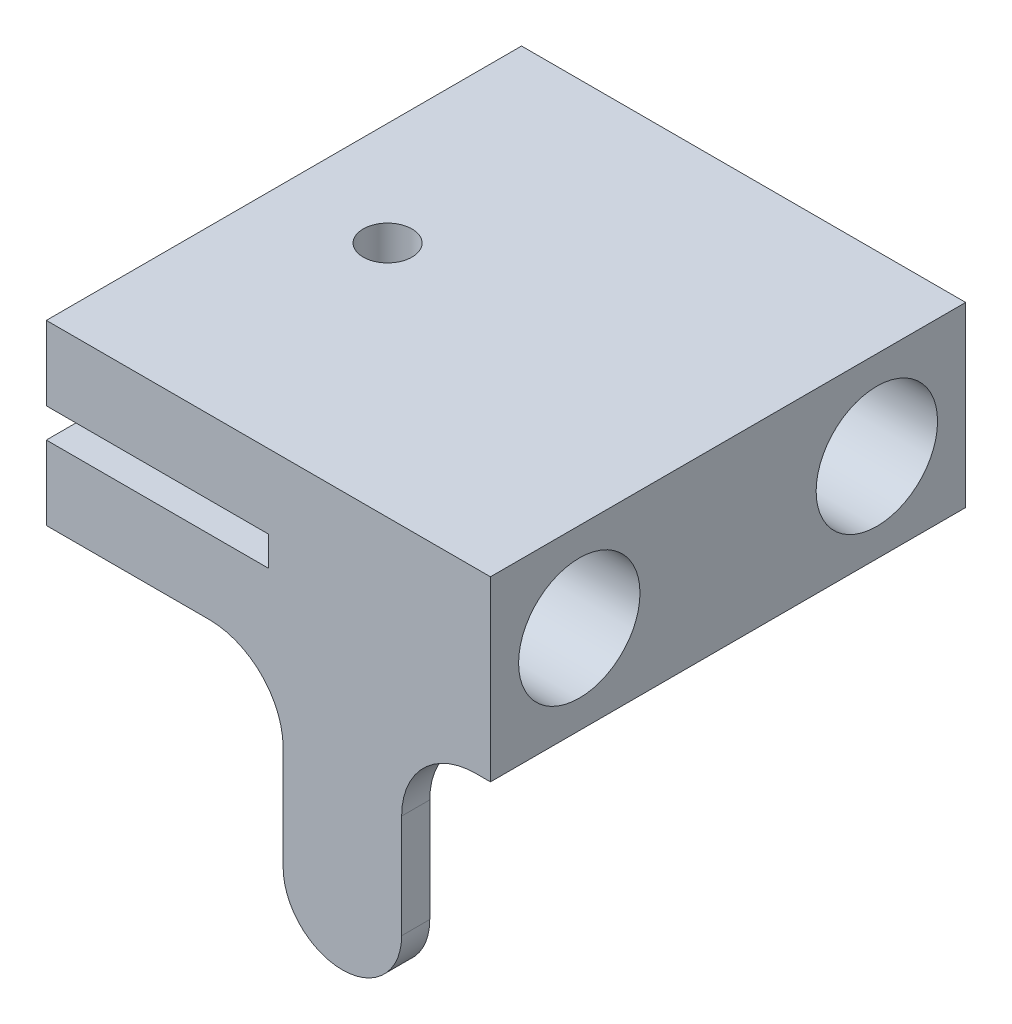
from build123d import *

# Parameters (mm, degrees)
CROQUIS1_W              = 32.1
CROQUIS1_H              = 12
CROQUIS1_R              = 4.1
SALIENTE_EXTRUIR1_DEPTH = 30
CROQUIS2_W              = 15
CROQUIS2_H              = 2
CORTAR_EXTRUIR2_DEPTH   = 33
CROQUIS4_R              = 1.65
CORTAR_EXTRUIR3_DEPTH   = 12
CROQUIS5_R              = 3.1
CORTAR_EXTRUIR4_DEPTH   = 2
SALIENTE_EXTRUIR2_DEPTH = 16
REDONDEO1_R             = 5
REDONDEO2_R             = 5
REDONDEO3_RADIUS        = 4.002255821
REDONDEO3_LENGTH        = 1.9


with BuildPart() as part:
    # Croquis1 → Saliente-Extruir1 (new body)
    with BuildSketch(Plane(origin=(0, 0, 0), x_dir=(0, 0, -1), z_dir=(1, 0, 0))):
        Rectangle(CROQUIS1_W, CROQUIS1_H)
        with Locations((-10.05, 0)):
            Circle(CROQUIS1_R, mode=Mode.SUBTRACT)
        with Locations((10.05, 0)):
            Circle(CROQUIS1_R, mode=Mode.SUBTRACT)
    extrude(amount=SALIENTE_EXTRUIR1_DEPTH)

    # Croquis2 → Cortar-Extruir2 (cut)
    with BuildSketch(Plane.XY.offset(16.05)):
        with Locations((7.5, 0)):
            Rectangle(CROQUIS2_W, CROQUIS2_H)
    extrude(amount=-CORTAR_EXTRUIR2_DEPTH, mode=Mode.SUBTRACT)

    # Croquis4 → Cortar-Extruir3 (cut)
    with BuildSketch(Plane(origin=(0, 6, 0), x_dir=(1, 0, 0), z_dir=(0, 1, 0))):
        with Locations(Location((7, 0, 0), (0, 0, 270))):
            Circle(CROQUIS4_R)
    extrude(amount=-CORTAR_EXTRUIR3_DEPTH, mode=Mode.SUBTRACT)

    # Croquis5 → Cortar-Extruir4 (cut)
    with BuildSketch(Plane.XZ.offset(6)):
        with Locations(Location((7, 0, 0), (0, 0, 270))):
            Circle(CROQUIS5_R)
    extrude(amount=-CORTAR_EXTRUIR4_DEPTH, mode=Mode.SUBTRACT)

    # Croquis7 → Saliente-Extruir2 (add)
    with BuildSketch(Plane.XZ.offset(6)):
        Polygon((20, 14.15), (24, 14.15), (24, 16.05), (15.995488358, 16.05), (15.995488358, 14.15), align=None)
    extrude(amount=SALIENTE_EXTRUIR2_DEPTH)

    # Redondeo1
    redondeo1_edges = [part.edges().sort_by_distance(p)[0] for p in [
        (15.995488358, -6, 15.1),
    ]]
    fillet(redondeo1_edges, radius=REDONDEO1_R)

    # Redondeo2
    redondeo2_edges = [part.edges().sort_by_distance(p)[0] for p in [
        (24, -6, 15.1),
    ]]
    fillet(redondeo2_edges, radius=REDONDEO2_R)

    # Redondeo3: full round fillet: the end face becomes a half cylinder, R = half its width
    redondeo3_face = Plane((19.997744179, -22, 15.1), x_dir=(0, 0, 1), z_dir=(0, -1, 0))  # on the end face: x along it, z out of the body
    redondeo3_slab = redondeo3_face.offset(-REDONDEO3_RADIUS / 2) * Box(REDONDEO3_LENGTH, 2 * REDONDEO3_RADIUS, REDONDEO3_RADIUS, mode=Mode.PRIVATE)  # the body's end, R deep
    redondeo3_round = Plane((19.997744179, -17.997744179, 15.1), x_dir=(0, -1, 0), z_dir=(0, 0, 1)) * Cylinder(REDONDEO3_RADIUS, REDONDEO3_LENGTH, mode=Mode.PRIVATE)  # its axis R under the face
    add(redondeo3_slab - redondeo3_round, mode=Mode.SUBTRACT)


solid = part.part
